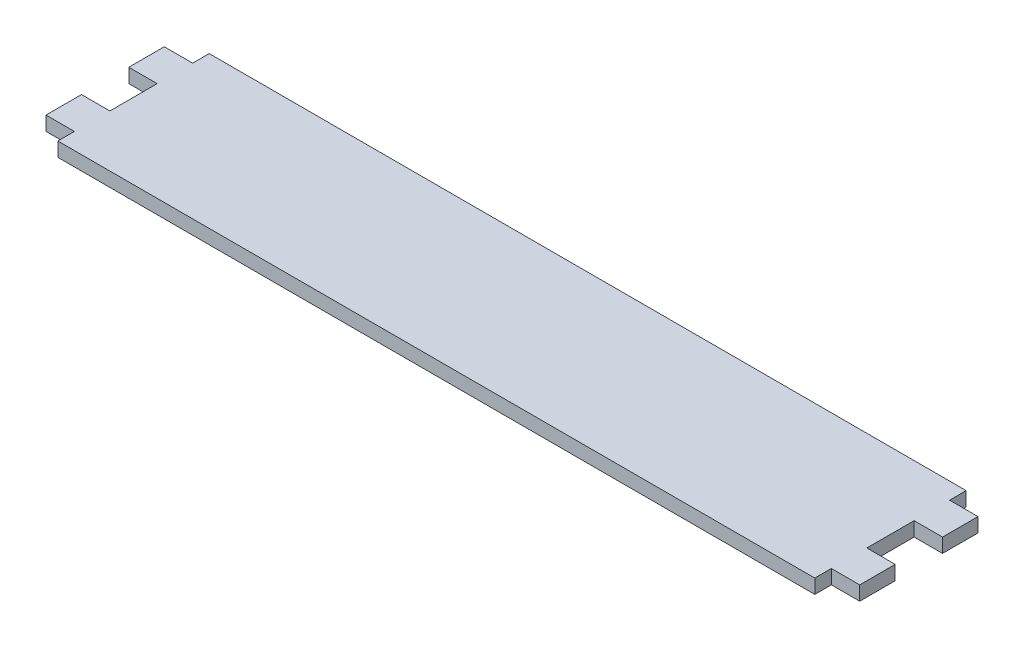
from build123d import *

# Parameters (mm, degrees)
SKIZZE1_W                       = 320
SKIZZE1_H                       = 64
GRUNDFORM_DEPTH                 = 6
SKIZZE3_W                       = 15
SKIZZE3_H                       = 6
AUFSATZ_LINEAR_AUSTRAGEN2_DEPTH = 12


with BuildPart() as part:
    # Skizze1 → Grundform (new body)
    with BuildSketch(Plane(origin=(0, 0, 0), x_dir=(1, 0, 0), z_dir=(0, 1, 0))):
        Rectangle(SKIZZE1_W, SKIZZE1_H)
    extrude(amount=GRUNDFORM_DEPTH)

    # Skizze3 → Aufsatz-Linear austragen2 (add)
    with BuildSketch(Plane.ZY.offset(160)):
        with Locations((-17.5, 3)):
            Rectangle(SKIZZE3_W, SKIZZE3_H)
        with Locations((17.5, 3)):
            Rectangle(SKIZZE3_W, SKIZZE3_H)
    aufsatz_linear_austragen2 = extrude(amount=AUFSATZ_LINEAR_AUSTRAGEN2_DEPTH)

    # Spiegeln1: Aufsatz-Linear austragen2 across plane
    add(aufsatz_linear_austragen2.mirror(Plane(origin=(0, 0, 0), x_dir=(0, 0, 1), z_dir=(1, 0, 0))))


solid = part.part
